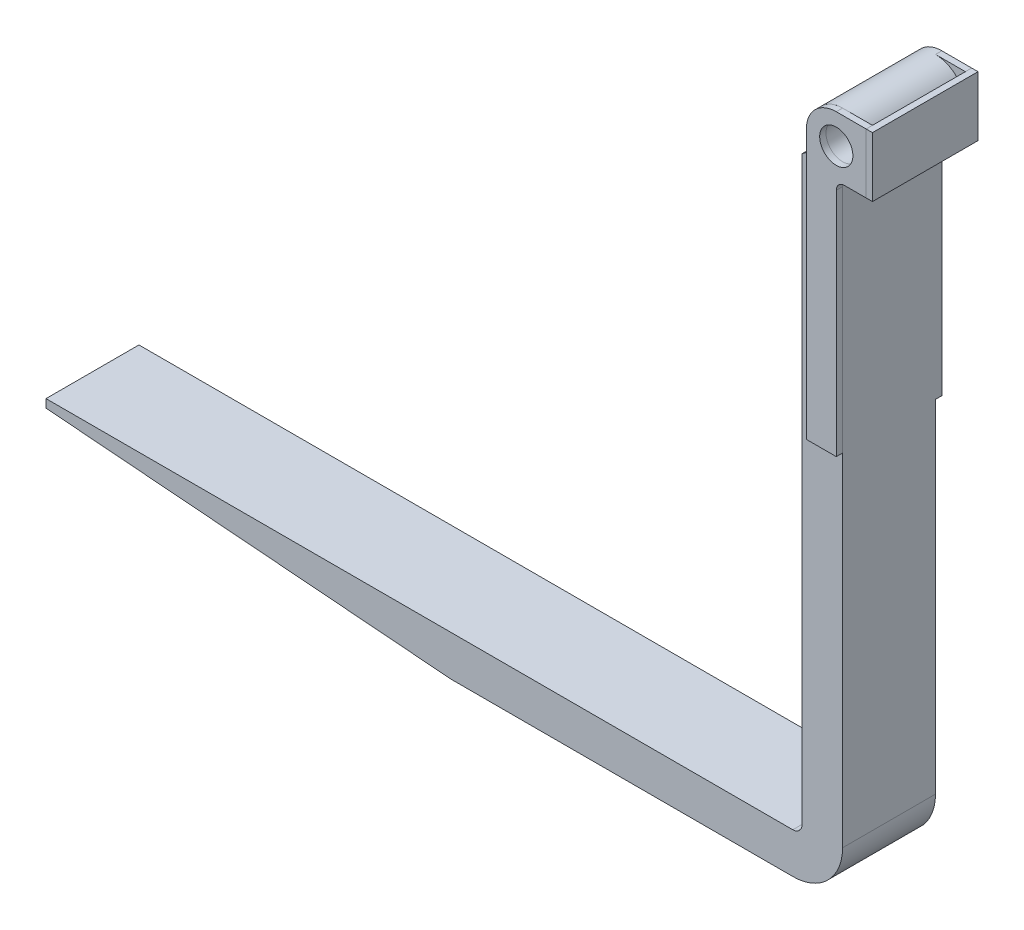
from build123d import *

# Parameters (mm, degrees)
EXTRUDE_THIN1_DEPTH     = 70
CUT_EXTRUDE1_DEPTH      = 1537.912489376
CUT_EXTRUDE1_DEPTH_BACK = 1537.912489376
SKETCH3_R               = 45
SKETCH3_R_2             = 25
BOSS_EXTRUDE1_DEPTH     = 70
BOSS_EXTRUDE2_DEPTH     = 70
SKETCH5_R               = 45
SKETCH5_R_2             = 25
BOSS_EXTRUDE3_DEPTH     = 9.5
SKETCH6_W               = 159
SKETCH6_H               = 90
BOSS_EXTRUDE4_DEPTH     = 9.5


with BuildPart() as part:
    # Sketch1 → Extrude-Thin1 (new, symmetric)
    with BuildSketch(Plane.XY):
        with BuildLine():
            Line((0, 950), (0, 75))
            ThreePointArc((0, 75), (-21.966991411, 21.966991411), (-75, 0))
            Line((-75, 0), (-1200, 0))
            Line((-1200, 0), (-1200, 61))
            Line((-1200, 61), (-75, 61))
            ThreePointArc((-75, 61), (-65.100505063, 65.100505063), (-61, 75))
            Line((-61, 75), (-61, 950))
            Line((-61, 950), (0, 950))
        make_face()
    extrude(amount=EXTRUDE_THIN1_DEPTH, both=True)

    # Sketch2 → Cut-Extrude1 (cut, two sides: drawn at the far end of the back side and taken through both)
    with BuildSketch(Plane.XY.offset(70).offset(-CUT_EXTRUDE1_DEPTH_BACK)):
        Polygon((-4202.326226889, 287.209544269), (-1200, 48.5), (-590, 0), (2412.326226889, -238.709544269), (1934.907138351, -6243.361998046), (-4679.745315427, -5717.442909508), align=None)
    extrude(amount=CUT_EXTRUDE1_DEPTH + CUT_EXTRUDE1_DEPTH_BACK, mode=Mode.SUBTRACT)


with BuildPart() as body_2:
    # Sketch3 → Boss-Extrude1 (new, symmetric)
    with BuildSketch(Plane.XY):
        with Locations((0, 995)):
            Circle(SKETCH3_R)
        with Locations((0, 995)):
            Circle(SKETCH3_R_2, mode=Mode.SUBTRACT)
    extrude(amount=BOSS_EXTRUDE1_DEPTH, both=True)


with BuildPart() as body_3:
    # Sketch4 → Boss-Extrude2 (new, symmetric)
    with BuildSketch(Plane.XY):
        with BuildLine():
            Line((-36.212585863, 968.285797314), (-61, 950))
            Line((-61, 950), (0, 950))
            ThreePointArc((0, 950), (-20.283748164, 954.830738612), (-36.212585863, 968.285797314))
        make_face()
    extrude(amount=BOSS_EXTRUDE2_DEPTH, both=True)


with BuildPart() as body_4:
    # Sketch5 → Boss-Extrude3 (new body)
    # profile 1 of 3: a face of its own
    with BuildSketch(Plane.XY.offset(70)):
        with Locations((0, 995)):
            Circle(SKETCH5_R)
        with Locations((0, 995)):
            Circle(SKETCH5_R_2, mode=Mode.SUBTRACT)
    # profile 2 of 3: a face of its own
    with BuildSketch(Plane.XY.offset(70)):
        with BuildLine():
            ThreePointArc((45, 995), (0, 950), (-45, 995))
            Line((-45, 995), (-45, 590))
            Line((-45, 590), (0, 590))
            Line((0, 590), (0, 937.5))
            ThreePointArc((0, 937.5), (3.661165235, 946.338834765), (12.5, 950))
            Line((12.5, 950), (45, 950))
            Line((45, 950), (45, 995))
        make_face()
    # profile 3 of 3: a face of its own
    with BuildSketch(Plane.XY.offset(70)):
        with BuildLine():
            Line((45, 1040), (0, 1040))
            ThreePointArc((0, 1040), (31.819805153, 1026.819805153), (45, 995))
            Line((45, 995), (45, 1040))
        make_face()
    boss_extrude3 = extrude(amount=BOSS_EXTRUDE3_DEPTH)


with BuildPart() as part_1:
    add(part.part)

    add(body_2.part)  # Mirror1 merges body 2

    add(body_3.part)  # Mirror1 merges body 3
    # Mirror1: Boss-Extrude3 across plane
    add(boss_extrude3.mirror(Plane.XY))


with BuildPart() as body_3_2:
    # Sketch6 → Boss-Extrude4 (new body)
    with BuildSketch(Plane(origin=(45, 0, 0), x_dir=(0, 0, -1), z_dir=(1, 0, 0))):
        with Locations((0, 995)):
            Rectangle(SKETCH6_W, SKETCH6_H)
    extrude(amount=BOSS_EXTRUDE4_DEPTH)


solid = Compound([body_4.part, part_1.part, body_3_2.part])
